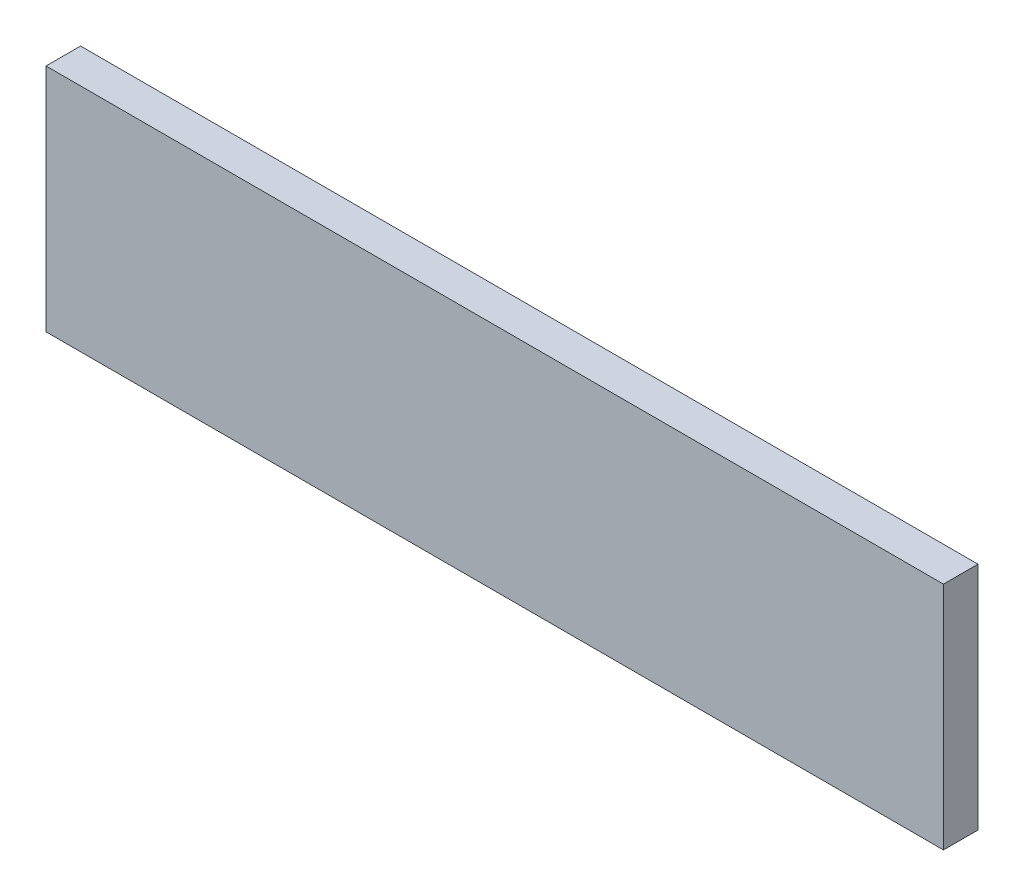
from build123d import *

# Parameters (mm, degrees)
SKETCH1_W           = 495.046
SKETCH1_H           = 127
BOSS_EXTRUDE1_DEPTH = 19.05


with BuildPart() as part:
    # Sketch1 → Boss-Extrude1 (new body)
    with BuildSketch(Plane.XY):
        with Locations((90.196398512, 5348.331529292)):
            Rectangle(SKETCH1_W, SKETCH1_H)
    extrude(amount=BOSS_EXTRUDE1_DEPTH)


solid = part.part
